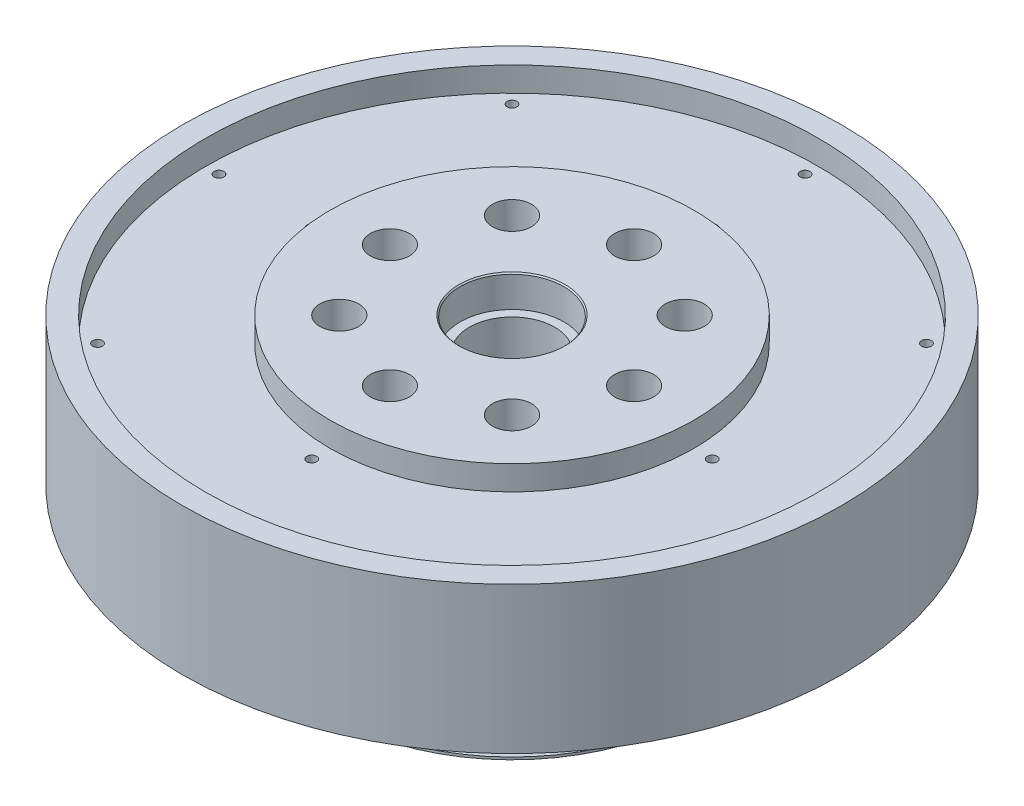
from build123d import *

# Parameters (mm, degrees)
CUT_EXTRUDE1_DEPTH      = 205.758394211
CUT_EXTRUDE1_DEPTH_BACK = 205.758394211
SKETCH2_R               = 4
SKETCH3_R               = 2
CUT_EXTRUDE2_DEPTH      = 15
SKETCH4_R               = 8
CUT_EXTRUDE3_DEPTH      = 12
BOSS_EXTRUDE1_START     = 30
SKETCH5_R               = 74.5
SKETCH5_R_2             = 4
SKETCH5_R_3             = 17.5
BOSS_EXTRUDE1_DEPTH     = 1


with BuildPart() as part:
    # Sketch1 → Revolve1 (revolve)
    with BuildSketch(Plane(origin=(0, 0, 0), x_dir=(0, 0, -1), z_dir=(1, 0, 0))):
        Polygon((-135, 60), (-135, 0), (-125.5, 0), (-125.5, 10), (-74.5, 10), (-74.5, 0), (-74.5, -14), (-20, -14), (-17.5, -11.5), (-17.5, 47), (-21.25, 47), (-21.25, 59.5), (-21.75, 60), (-74.5, 60), (-74.5, 50), (-125.5, 50), (-125.5, 60), align=None)
    revolve(axis=Axis((0, -14, 0), (0, -1, 0)))

    # Sketch2 → Cut-Extrude1 (cut, two sides: drawn at the far end of the back side and taken through both)
    with BuildSketch(Plane(origin=(0, 60, 0), x_dir=(1, 0, 0), z_dir=(0, 1, 0)).offset(-CUT_EXTRUDE1_DEPTH_BACK)):
        with Locations(Location((-50, 0, 0), (0, 0, 270))):
            Circle(SKETCH2_R)
        with Locations(Location((-35.355339059, 35.355339059, 0), (0, 0, 270))):
            Circle(SKETCH2_R)
        with Locations(Location((0, 50, 0), (0, 0, 270))):
            Circle(SKETCH2_R)
        with Locations(Location((35.355339059, 35.355339059, 0), (0, 0, 270))):
            Circle(SKETCH2_R)
        with Locations(Location((50, 0, 0), (0, 0, 270))):
            Circle(SKETCH2_R)
        with Locations(Location((35.355339059, -35.355339059, 0), (0, 0, 270))):
            Circle(SKETCH2_R)
        with Locations(Location((0, -50, 0), (0, 0, 270))):
            Circle(SKETCH2_R)
        with Locations(Location((-35.355339059, -35.355339059, 0), (0, 0, 270))):
            Circle(SKETCH2_R)
    extrude(amount=CUT_EXTRUDE1_DEPTH + CUT_EXTRUDE1_DEPTH_BACK, mode=Mode.SUBTRACT)

    # Sketch3 → Cut-Extrude2 (cut)
    with BuildSketch(Plane.XZ.offset(-10)):
        with Locations(Location((0, 82, 0), (0, 0, 270))):
            Circle(SKETCH3_R)
        with Locations(Location((0, 120, 0), (0, 0, 270))):
            Circle(SKETCH3_R)
        with Locations(Location((84.852813742, 84.852813742, 0), (0, 0, 270))):
            Circle(SKETCH3_R)
        with Locations(Location((120, 0, 0), (0, 0, 270))):
            Circle(SKETCH3_R)
        with Locations(Location((82, 0, 0), (0, 0, 270))):
            Circle(SKETCH3_R)
        with Locations(Location((84.852813742, -84.852813742, 0), (0, 0, 270))):
            Circle(SKETCH3_R)
        with Locations(Location((0, -120, 0), (0, 0, 270))):
            Circle(SKETCH3_R)
        with Locations(Location((0, -82, 0), (0, 0, 270))):
            Circle(SKETCH3_R)
        with Locations(Location((-84.852813742, -84.852813742, 0), (0, 0, 270))):
            Circle(SKETCH3_R)
        with Locations(Location((-120, 0, 0), (0, 0, 270))):
            Circle(SKETCH3_R)
        with Locations(Location((-82, 0, 0), (0, 0, 270))):
            Circle(SKETCH3_R)
        with Locations(Location((-84.852813742, 84.852813742, 0), (0, 0, 270))):
            Circle(SKETCH3_R)
    cut_extrude2 = extrude(amount=-CUT_EXTRUDE2_DEPTH, mode=Mode.SUBTRACT)

    # Mirror1: Cut-Extrude2 across plane
    add(cut_extrude2.mirror(Plane(origin=(0, 30, 0), x_dir=(0, 0, 1), z_dir=(0, -1, 0))), mode=Mode.SUBTRACT)

    # Sketch4 → Cut-Extrude3 (cut)
    with BuildSketch(Plane(origin=(0, 60, 0), x_dir=(1, 0, 0), z_dir=(0, 1, 0))):
        with Locations(Location((0, 50, 0), (0, 0, 270))):
            Circle(SKETCH4_R)
        with Locations(Location((35.355339059, 35.355339059, 0), (0, 0, 270))):
            Circle(SKETCH4_R)
        with Locations(Location((50, 0, 0), (0, 0, 270))):
            Circle(SKETCH4_R)
        with Locations(Location((35.355339059, -35.355339059, 0), (0, 0, 270))):
            Circle(SKETCH4_R)
        with Locations(Location((0, -50, 0), (0, 0, 270))):
            Circle(SKETCH4_R)
        with Locations(Location((-35.355339059, -35.355339059, 0), (0, 0, 270))):
            Circle(SKETCH4_R)
        with Locations(Location((-50, 0, 0), (0, 0, 270))):
            Circle(SKETCH4_R)
        with Locations(Location((-35.355339059, 35.355339059, 0), (0, 0, 270))):
            Circle(SKETCH4_R)
    extrude(amount=-CUT_EXTRUDE3_DEPTH, mode=Mode.SUBTRACT)


with BuildPart() as body_2:
    # Sketch5 → Boss-Extrude1 (new body)
    with BuildSketch(Plane.XZ.offset(14).offset(BOSS_EXTRUDE1_START)):
        with Locations(Location((0, 0, 0), (0, 0, 270))):
            Circle(SKETCH5_R)
        with Locations(Location((35.355339059, -35.355339059, 0), (0, 0, 270))):
            Circle(SKETCH5_R_2, mode=Mode.SUBTRACT)
        with Locations(Location((0, -50, 0), (0, 0, 270))):
            Circle(SKETCH5_R_2, mode=Mode.SUBTRACT)
        with Locations(Location((-35.355339059, -35.355339059, 0), (0, 0, 270))):
            Circle(SKETCH5_R_2, mode=Mode.SUBTRACT)
        with Locations(Location((-50, 0, 0), (0, 0, 270))):
            Circle(SKETCH5_R_2, mode=Mode.SUBTRACT)
        with Locations(Location((50, 0, 0), (0, 0, 270))):
            Circle(SKETCH5_R_2, mode=Mode.SUBTRACT)
        with Locations(Location((35.355339059, 35.355339059, 0), (0, 0, 270))):
            Circle(SKETCH5_R_2, mode=Mode.SUBTRACT)
        with Locations(Location((-35.355339059, 35.355339059, 0), (0, 0, 270))):
            Circle(SKETCH5_R_2, mode=Mode.SUBTRACT)
        with Locations(Location((0, 50, 0), (0, 0, 270))):
            Circle(SKETCH5_R_2, mode=Mode.SUBTRACT)
        with Locations(Location((0, 0, 0), (0, 0, 270))):
            Circle(SKETCH5_R_3, mode=Mode.SUBTRACT)
    extrude(amount=BOSS_EXTRUDE1_DEPTH)


solid = Compound([part.part, body_2.part])
